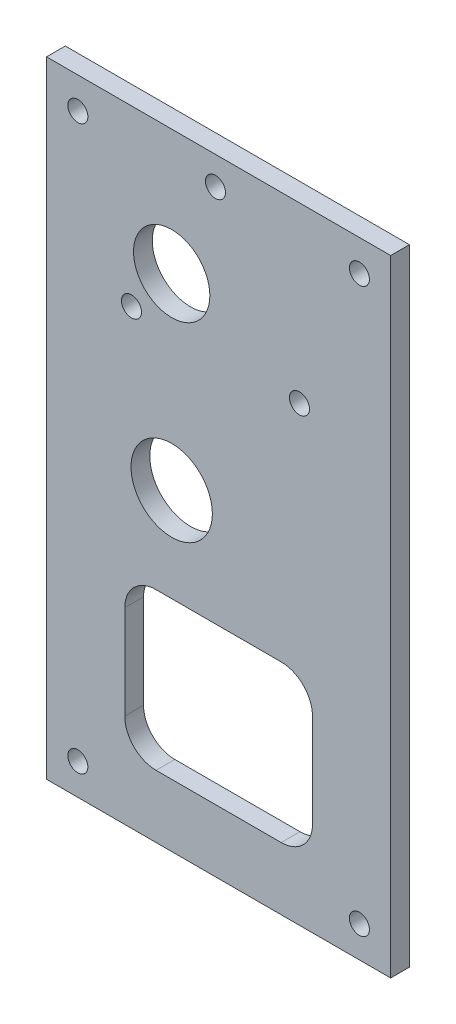
from build123d import *

# Parameters (mm, degrees)
SKETCH_1_W          = 55
SKETCH_1_H          = 100
EXTRUDE_1_DEPTH     = 1.5
SKETCH_2_R          = 6.1
SKETCH_2_R_2        = 6.5
SKETCH_2_R_3        = 1.6
CUT_EXTRUDE_1_DEPTH = 58.142366069
SKETCH_3_R          = 1.6
CUT_EXTRUDE_2_DEPTH = 58.142366069
SKETCH_4_W          = 30
SKETCH_4_H          = 25
CUT_EXTRUDE_3_DEPTH = 58.142366069
FILLET_1_R          = 5


with BuildPart() as part:
    # ｽｹｯﾁ1 → ﾎﾞｽ - 押し出し1 (new, symmetric)
    with BuildSketch(Plane.XY):
        Rectangle(SKETCH_1_W, SKETCH_1_H)
    extrude(amount=EXTRUDE_1_DEPTH, both=True)

    # ｽｹｯﾁ2 → ｶｯﾄ - 押し出し1 (cut, through all)
    with BuildSketch(Plane.XY.offset(1.5)):
        with Locations((-7.5, 30)):
            Circle(SKETCH_2_R)
        with Locations((-7.5, 0)):
            Circle(SKETCH_2_R_2)
        with Locations((12.923393759, 22.25)):
            Circle(SKETCH_2_R_3)
        with Locations((-0.5, 45.5)):
            Circle(SKETCH_2_R_3)
        with Locations((-13.923393759, 22.25)):
            Circle(SKETCH_2_R_3)
    extrude(amount=-CUT_EXTRUDE_1_DEPTH, mode=Mode.SUBTRACT)

    # ｽｹｯﾁ3 → ｶｯﾄ - 押し出し2 (cut, through all)
    with BuildSketch(Plane.XY.offset(1.5)):
        with Locations((-22.5, 45)):
            Circle(SKETCH_3_R)
        with Locations(Location((22.5, 45, 0), (0, 0, 180))):
            Circle(SKETCH_3_R)
        with Locations((22.5, -45)):
            Circle(SKETCH_3_R)
        with Locations(Location((-22.5, -45, 0), (0, 0, 180))):
            Circle(SKETCH_3_R)
    extrude(amount=-CUT_EXTRUDE_2_DEPTH, mode=Mode.SUBTRACT)

    # ｽｹｯﾁ4 → ｶｯﾄ - 押し出し3 (cut, through all)
    with BuildSketch(Plane.XY.offset(1.5)):
        with Locations((0, -27.5)):
            Rectangle(SKETCH_4_W, SKETCH_4_H)
    extrude(amount=-CUT_EXTRUDE_3_DEPTH, mode=Mode.SUBTRACT)

    # ﾌｨﾚｯﾄ1
    fillet_1_edges = [part.edges().sort_by_distance(p)[0] for p in [
        (15, -15, 0),
        (15, -40, 0),
        (-15, -40, 0),
        (-15, -15, 0),
    ]]
    fillet(fillet_1_edges, radius=FILLET_1_R)


solid = part.part
